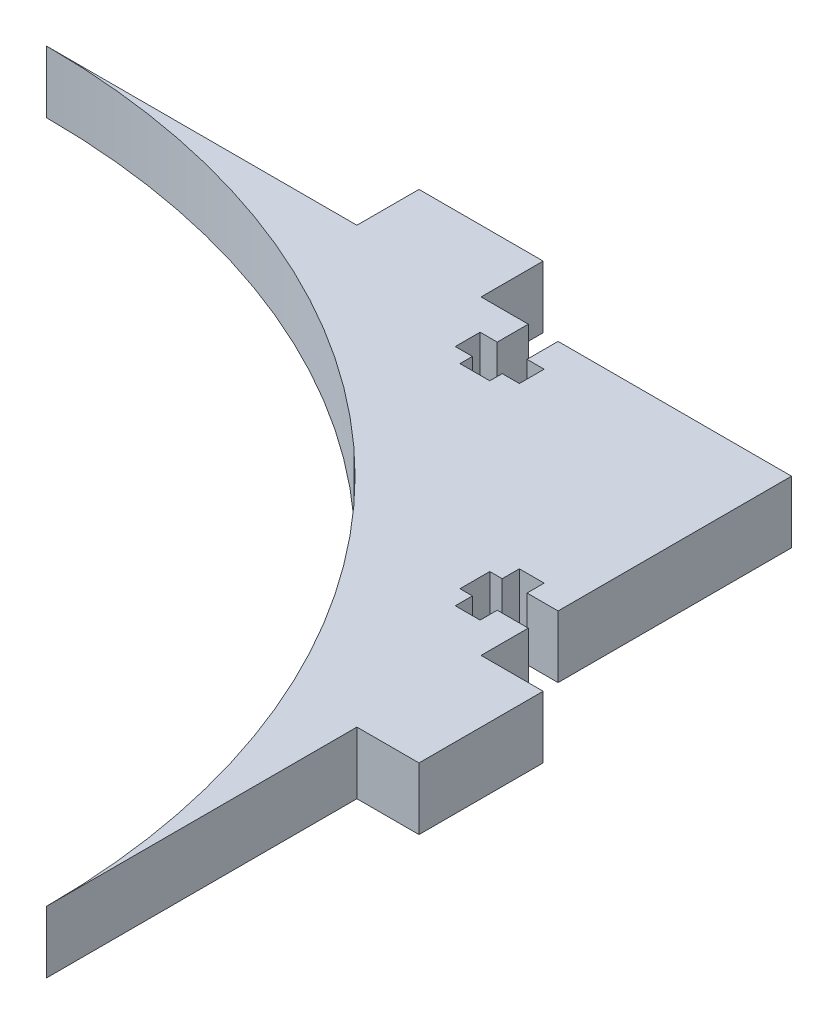
from build123d import *

# Parameters (mm, degrees)
BOSS_EXTRUDE1_DEPTH = 6.35


with BuildPart() as part:
    # Sketch1 → Boss-Extrude1 (new body)
    with BuildSketch(Plane(origin=(0, 0, 0), x_dir=(1, 0, 0), z_dir=(0, 1, 0))):
        with BuildLine():
            Line((-172.086243064, 25.662027693), (-140.336243064, 25.662027693))
            Line((-140.336243064, 25.662027693), (-140.336243064, 32.012027693))
            Line((-140.336243064, 32.012027693), (-127.636243064, 32.012027693))
            Line((-127.636243064, 32.012027693), (-127.636243064, 25.662027693))
            Line((-127.636243064, 25.662027693), (-122.810172742, 25.662027693))
            Line((-122.810172742, 25.662027693), (-122.810172742, 22.487027693))
            Line((-122.810172742, 22.487027693), (-124.562772742, 22.487027693))
            Line((-124.562772742, 22.487027693), (-124.562772742, 19.947027693))
            Line((-124.562772742, 19.947027693), (-122.810172742, 19.947027693))
            Line((-122.810172742, 19.947027693), (-122.810172742, 18.677027693))
            Line((-122.810172742, 18.677027693), (-119.762313386, 18.677027693))
            Line((-119.762313386, 18.677027693), (-119.762313386, 19.947027693))
            Line((-119.762313386, 19.947027693), (-118.009713386, 19.947027693))
            Line((-118.009713386, 19.947027693), (-118.009713386, 22.487027693))
            Line((-118.009713386, 22.487027693), (-119.762313386, 22.487027693))
            Line((-119.762313386, 22.487027693), (-119.762313386, 25.662027693))
            Line((-119.762313386, 25.662027693), (-95.886243064, 25.662027693))
            Line((-95.886243064, 25.662027693), (-95.886243064, 1.785957371))
            Line((-95.886243064, 1.785957371), (-99.061243064, 1.785957371))
            Line((-99.061243064, 1.785957371), (-99.061243064, 3.538557371))
            Line((-99.061243064, 3.538557371), (-101.601243064, 3.538557371))
            Line((-101.601243064, 3.538557371), (-101.601243064, 1.785957371))
            Line((-101.601243064, 1.785957371), (-102.871243064, 1.785957371))
            Line((-102.871243064, 1.785957371), (-102.871243064, -1.261901985))
            Line((-102.871243064, -1.261901985), (-101.601243064, -1.261901985))
            Line((-101.601243064, -1.261901985), (-101.601243064, -3.014501985))
            Line((-101.601243064, -3.014501985), (-99.061243064, -3.014501985))
            Line((-99.061243064, -3.014501985), (-99.061243064, -1.261901985))
            Line((-99.061243064, -1.261901985), (-95.886243064, -1.261901985))
            Line((-95.886243064, -1.261901985), (-95.886243064, -6.087972307))
            Line((-95.886243064, -6.087972307), (-89.536243064, -6.087972307))
            Line((-89.536243064, -6.087972307), (-89.536243064, -18.787972307))
            Line((-89.536243064, -18.787972307), (-95.886243064, -18.787972307))
            Line((-95.886243064, -18.787972307), (-95.886243064, -50.537972307))
            ThreePointArc((-95.886243064, -50.537972307), (-118.204706338, 3.34356442), (-172.086243064, 25.662027693))
        make_face()
    extrude(amount=BOSS_EXTRUDE1_DEPTH)


solid = part.part
